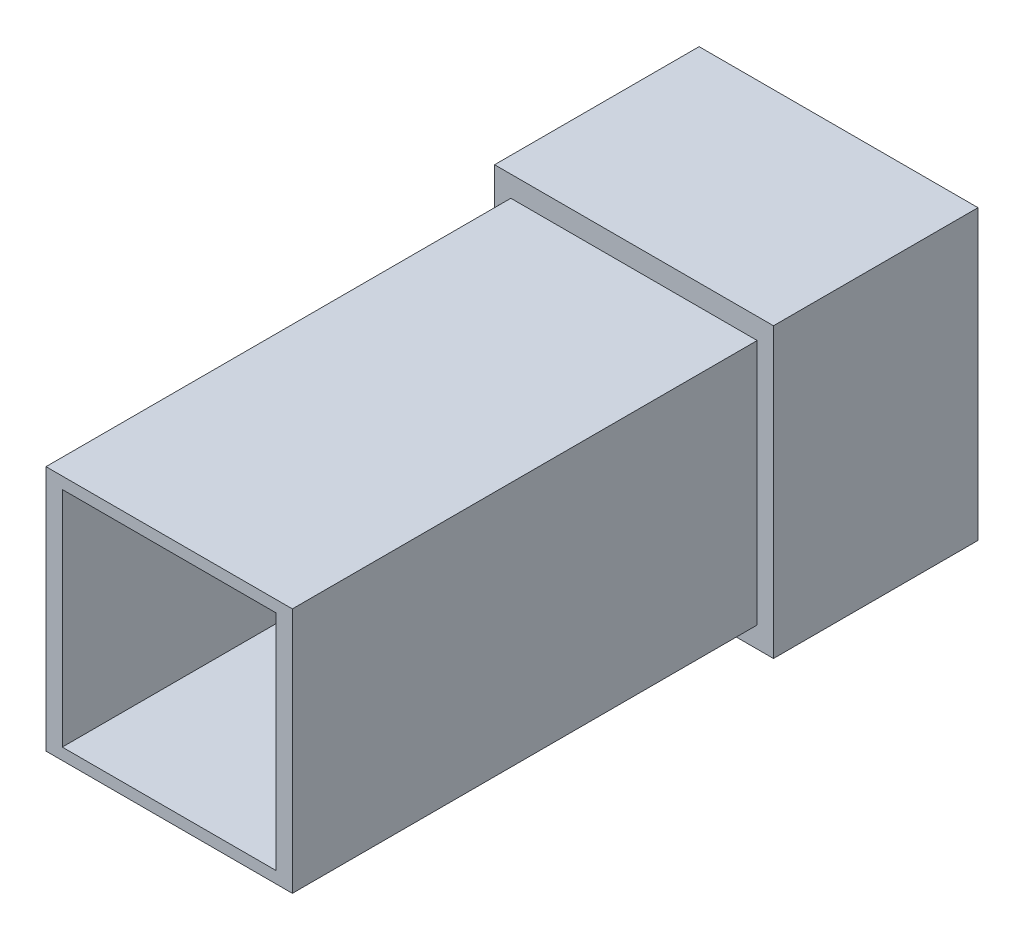
from build123d import *

# Parameters (mm, degrees)
SKETCH1_W             = 76.2
SKETCH1_H             = 78.74
SKETCH1_W_2           = 68.58
SKETCH1_H_2           = 71.12
BOSS_EXTRUDE1_DEPTH   = 50.8
SKETCH1_W_3           = 63.5
SKETCH1_H_3           = 66.04
SKETCH1_W_4           = 58.42
SKETCH1_H_4           = 60.96
BOSS_EXTRUDE1_2_DEPTH = 50.8
SKETCH2_W             = 76.2
SKETCH2_H             = 78.74
SKETCH2_W_2           = 58.42
SKETCH2_H_2           = 60.96
BOSS_EXTRUDE2_DEPTH   = 5.08
SKETCH3_W             = 67.31
SKETCH3_H             = 67.31
SKETCH3_W_2           = 58.42
SKETCH3_H_2           = 60.96
BOSS_EXTRUDE3_DEPTH   = 127


with BuildPart() as part:
    # Sketch1 → Boss-Extrude1 (new body)
    with BuildSketch(Plane.XY):
        with Locations((34.29, 35.56)):
            Rectangle(SKETCH1_W, SKETCH1_H)
        with Locations((34.29, 35.56)):
            Rectangle(SKETCH1_W_2, SKETCH1_H_2, mode=Mode.SUBTRACT)
    extrude(amount=BOSS_EXTRUDE1_DEPTH)



with BuildPart() as body_2:
    # Sketch1 → Boss-Extrude1 2 (new body)
    with BuildSketch(Plane.XY):
        with Locations((34.29, 35.56)):
            Rectangle(SKETCH1_W_3, SKETCH1_H_3)
        with Locations((34.29, 35.56)):
            Rectangle(SKETCH1_W_4, SKETCH1_H_4, mode=Mode.SUBTRACT)
    extrude(amount=BOSS_EXTRUDE1_2_DEPTH)


with BuildPart() as part_1:
    add(part.part)

    add(body_2.part)  # Boss-Extrude2 merges body 2
    # Sketch2 → Boss-Extrude2 (add)
    with BuildSketch(Plane.XY.offset(50.8)):
        with Locations((34.29, 35.56)):
            Rectangle(SKETCH2_W, SKETCH2_H)
        with Locations((34.29, 35.56)):
            Rectangle(SKETCH2_W_2, SKETCH2_H_2, mode=Mode.SUBTRACT)
    extrude(amount=BOSS_EXTRUDE2_DEPTH)

    # Sketch3 → Boss-Extrude3 (add)
    with BuildSketch(Plane.XY.offset(55.88)):
        with Locations((34.29, 35.56)):
            Rectangle(SKETCH3_W, SKETCH3_H)
        with Locations((34.29, 35.56)):
            Rectangle(SKETCH3_W_2, SKETCH3_H_2, mode=Mode.SUBTRACT)
    extrude(amount=BOSS_EXTRUDE3_DEPTH)


solid = part_1.part
